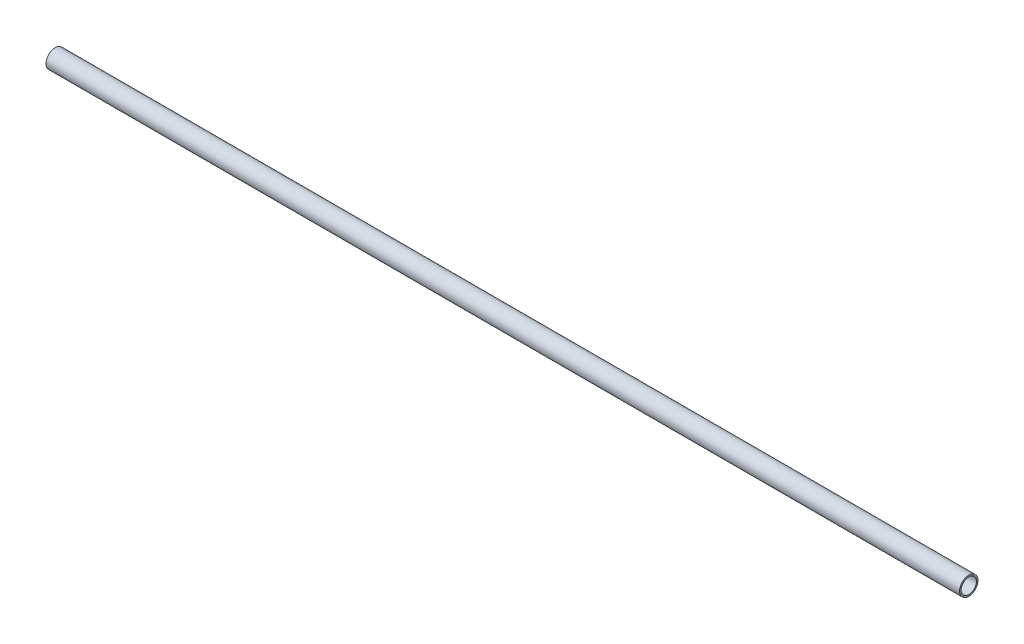
from build123d import *

# Parameters (mm, degrees)
SKETCH1_R           = 19.05
SKETCH1_R_2         = 15.875
BOSS_EXTRUDE1_DEPTH = 1892.3


with BuildPart() as part:
    # Sketch1 → Boss-Extrude1 (new body)
    with BuildSketch(Plane(origin=(0, 0, 0), x_dir=(0, 0, -1), z_dir=(1, 0, 0))):
        Circle(SKETCH1_R)
        Circle(SKETCH1_R_2, mode=Mode.SUBTRACT)
    extrude(amount=BOSS_EXTRUDE1_DEPTH)


solid = part.part
